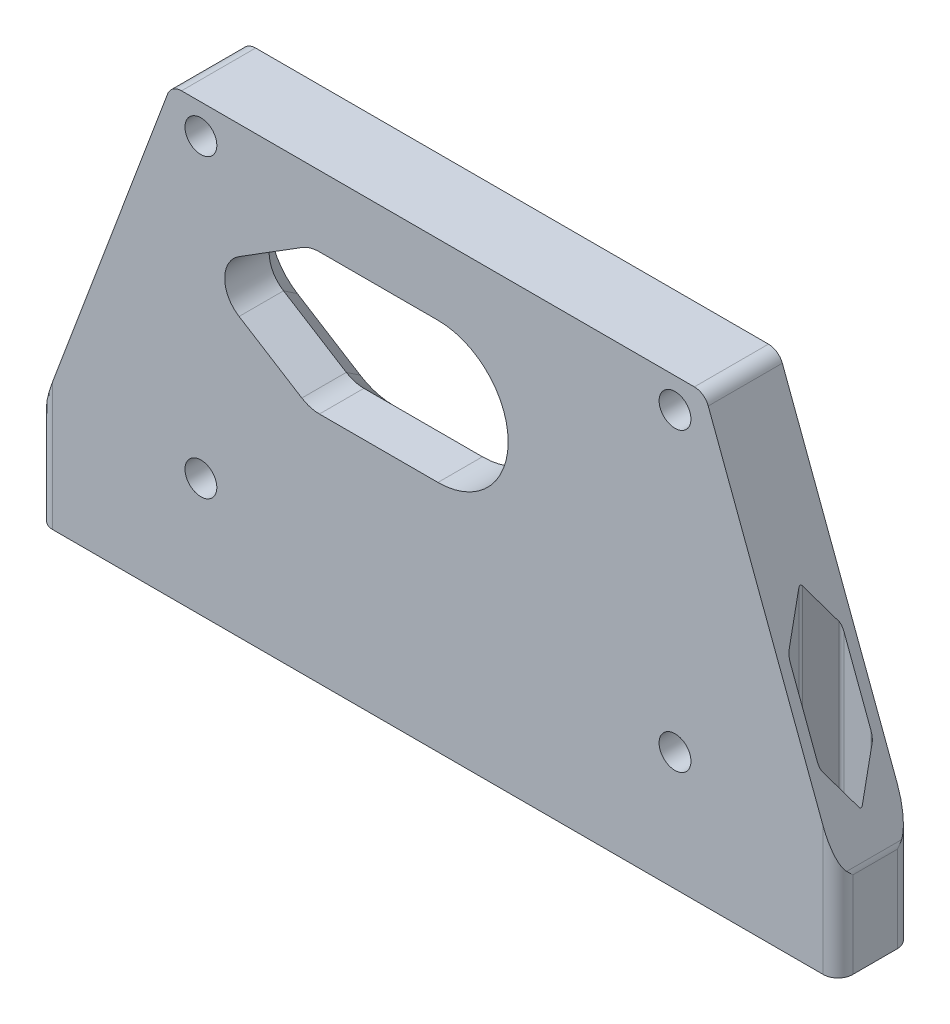
from build123d import *

# Parameters (mm, degrees)
SKETCH_1_R          = 2.15
EXTRUDE_1_DEPTH     = 10
SKETCH_2_R          = 2.15
CUT_EXTRUDE_1_DEPTH = 82.338797631
CUT_EXTRUDE_2_DEPTH = 50
FILLET_1_R          = 0.5
FILLET_2_R          = 2
SKETCH_4_R          = 9.478521267
SKETCH_4_R_2        = 4.478521267
SKETCH_4_R_3        = 4.1275
CUT_EXTRUDE_3_DEPTH = 82.338797631
CHAMFER_1_SIZE      = 4


with BuildPart() as part:
    # 草图1 → 凸台-拉伸1 (new body)
    with BuildSketch(Plane.XY):
        Polygon((-54, 0), (54, 0), (54, 12), (36, 60), (-36, 60), (-54, 12), align=None)
        with Locations((-32, 56)):
            Circle(SKETCH_1_R, mode=Mode.SUBTRACT)
        with Locations((32, 56)):
            Circle(SKETCH_1_R, mode=Mode.SUBTRACT)
        with Locations((32, 16)):
            Circle(SKETCH_1_R, mode=Mode.SUBTRACT)
        with Locations((-32, 16)):
            Circle(SKETCH_1_R, mode=Mode.SUBTRACT)
    extrude(amount=EXTRUDE_1_DEPTH)

    # 草图2 → 切除-拉伸1 (cut, through all)
    with BuildSketch(Plane.XZ):
        with Locations(Location((48, 5, 0), (0, 0, 270))):
            Circle(SKETCH_2_R)
        with Locations(Location((-48, 5, 0), (0, 0, 180))):
            Circle(SKETCH_2_R)
    extrude(amount=-CUT_EXTRUDE_1_DEPTH, mode=Mode.SUBTRACT)

    # 草图3 → 切除-拉伸2 (cut)
    with BuildSketch(Plane(origin=(0, 60, 0), x_dir=(1, 0, 0), z_dir=(0, 1, 0))):
        Polygon((-43.814210548, -5), (-45.907105274, -1.375), (-50.092894726, -1.375), (-52.185789452, -5), (-50.092894726, -8.625), (-45.907105274, -8.625), align=None)
        Polygon((43.814210548, -5), (45.907105274, -8.625), (50.092894726, -8.625), (52.185789452, -5), (50.092894726, -1.375), (45.907105274, -1.375), align=None)
    extrude(amount=-CUT_EXTRUDE_2_DEPTH, mode=Mode.SUBTRACT)

    # 圆角1
    fillet_1_edges = [part.edges().sort_by_distance(p)[0] for p in [
        (-43.814210548, 24.581052602, 5),
        (-45.907105274, 21.790526301, 8.625),
        (-50.092894726, 16.209473699, 8.625),
        (-52.185789452, 13.418947398, 5),
        (-50.092894726, 16.209473699, 1.375),
        (-45.907105274, 21.790526301, 1.375),
        (43.814210548, 24.581052602, 5),
        (45.907105274, 21.790526301, 1.375),
        (50.092894726, 16.209473699, 1.375),
        (52.185789452, 13.418947398, 5),
        (50.092894726, 16.209473699, 8.625),
        (45.907105274, 21.790526301, 8.625),
    ]]
    fillet(fillet_1_edges, radius=FILLET_1_R)

    # 圆角2
    fillet_2_edges = [part.edges().sort_by_distance(p)[0] for p in [
        (-54, 12, 5),
        (-36, 60, 5),
        (36, 60, 5),
        (54, 12, 5),
        (-54, 6, 10),
        (54, 6, 10),
        (-54, 6, 0),
        (54, 6, 0),
    ]]
    fillet(fillet_2_edges, radius=FILLET_2_R)

    # 草图4 → 切除-拉伸3 (cut, through all)
    with BuildSketch(Plane(origin=(0, 0, 0), x_dir=(-1, 0, 0), z_dir=(0, 0, -1))):
        with Locations((0, 41)):
            Circle(SKETCH_4_R)
        with BuildLine():
            Line((26.84820546, 44.499874972), (18.374024707, 49.797520169))
            ThreePointArc((18.374024707, 49.797520169), (19.917223052, 48.170833089), (20.478521267, 46))
            ThreePointArc((20.478521267, 46), (12.833207242, 42.833207242), (16, 50.478521267))
            Line((16, 50.478521267), (0, 50.478521267))
            ThreePointArc((0, 50.478521267), (6.702326663, 47.702326663), (9.478521267, 41))
            ThreePointArc((9.478521267, 41), (6.702326663, 34.297673337), (0, 31.521478733))
            Line((0, 31.521478733), (16, 31.521478733))
            ThreePointArc((16, 31.521478733), (12.833207242, 39.166792758), (20.478521267, 36))
            ThreePointArc((20.478521267, 36), (19.917223052, 33.829166911), (18.374024707, 32.202479831))
            Line((18.374024707, 32.202479831), (26.84820546, 37.500125028))
            ThreePointArc((26.84820546, 37.500125028), (20.532754038, 41), (26.84820546, 44.499874972))
        make_face()
        with Locations((16, 46)):
            Circle(SKETCH_4_R_2)
        with Locations((16, 36)):
            Circle(SKETCH_4_R_2)
        with Locations((24.660254038, 41)):
            Circle(SKETCH_4_R_3)
    extrude(amount=-CUT_EXTRUDE_3_DEPTH, mode=Mode.SUBTRACT)

    # 倒角1
    chamfer_1_edges = [part.edges().sort_by_distance(p)[0] for p in [
        (-8, 50.478521267, 0),
        (-22.611115084, 47.14869757, 0),
        (9.478521267, 41, 0),
        (-8, 31.521478733, 0),
        (-17.234884185, 31.695094218, 0),
        (-22.611115084, 34.85130243, 0),
        (-28.787754038, 41, 0),
        (-17.234884185, 50.304905782, 0),
    ]]
    chamfer(chamfer_1_edges, length=CHAMFER_1_SIZE)


solid = part.part
